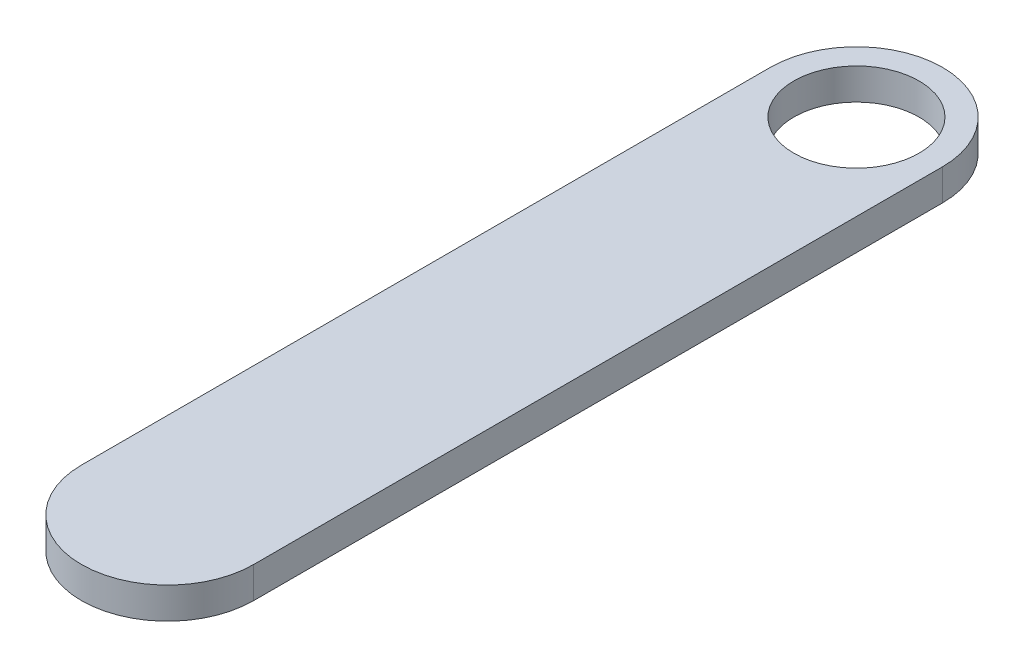
from build123d import *

# Parameters (mm, degrees)
SKETCH2_R           = 4
BOSS_EXTRUDE1_DEPTH = 2


with BuildPart() as part:
    # Sketch2 → Boss-Extrude1 (new body)
    with BuildSketch(Plane(origin=(0, 0, 0), x_dir=(1, 0, 0), z_dir=(0, 1, 0))):
        with BuildLine():
            Line((-5.5, 0), (-5.5, 44))
            ThreePointArc((-5.5, 44), (0, 49.5), (5.5, 44))
            Line((5.5, 44), (5.5, 0))
            ThreePointArc((5.5, 0), (0, -5.5), (-5.5, 0))
        make_face()
        with Locations(Location((0, 44, 0), (0, 0, 270))):
            Circle(SKETCH2_R, mode=Mode.SUBTRACT)
    extrude(amount=BOSS_EXTRUDE1_DEPTH)


solid = part.part
